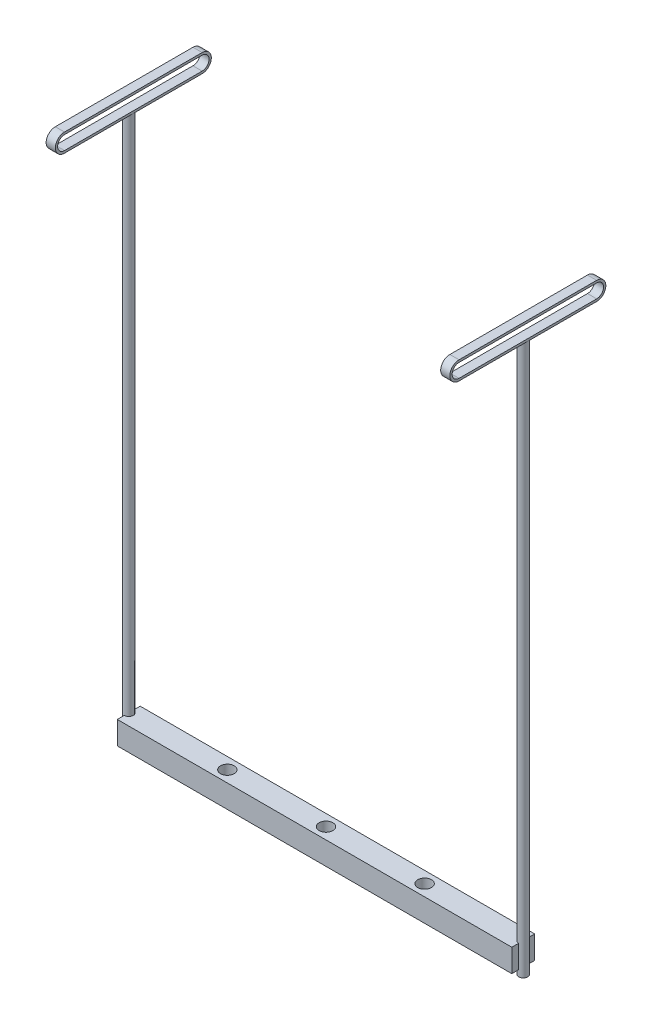
from build123d import *

# Parameters (mm, degrees)
BOSS_EXTRUDE1_DEPTH     = 10
SKETCH2_R               = 10
BOSS_EXTRUDE2_DEPTH     = 1200
SKETCH4_W               = 50
SKETCH4_H               = 50
BOSS_EXTRUDE3_DEPTH     = 860
CUT_EXTRUDE2_DEPTH      = 1468.122841414
CUT_EXTRUDE2_DEPTH_BACK = 1468.122841414
SKETCH6_R               = 15


with BuildPart() as part:
    # Sketch1 → Boss-Extrude1 (new, symmetric)
    with BuildSketch(Plane(origin=(0, 0, 0), x_dir=(0, 0, -1), z_dir=(1, 0, 0))):
        with BuildLine():
            Line((150, -20), (-150, -20))
            ThreePointArc((-150, -20), (-170, 0), (-150, 20))
            Line((-150, 20), (150, 20))
            ThreePointArc((150, 20), (170, 0), (150, -20))
        make_face()
        with BuildLine():
            Line((-150, 15), (150, 15))
            ThreePointArc((150, 15), (165, 0), (150, -15))
            Line((150, -15), (-150, -15))
            ThreePointArc((-150, -15), (-165, 0), (-150, 15))
        make_face(mode=Mode.SUBTRACT)
    boss_extrude1 = extrude(amount=BOSS_EXTRUDE1_DEPTH, both=True)

    # Sketch2 → Boss-Extrude2 (add)
    with BuildSketch(Plane.XZ.offset(20)):
        with Locations(Location((0, 0, 0), (0, 0, 180))):
            Circle(SKETCH2_R)
    boss_extrude2 = extrude(amount=BOSS_EXTRUDE2_DEPTH)

    # Sketch4 → Boss-Extrude3 (add)
    with BuildSketch(Plane(origin=(0, 0, 0), x_dir=(0, 0, -1), z_dir=(1, 0, 0))):
        with Locations((0, -1181.413801262)):
            Rectangle(SKETCH4_W, SKETCH4_H)
    extrude(amount=-BOSS_EXTRUDE3_DEPTH)

    # Sketch6 → Cut-Extrude2 (cut, two sides: drawn at the far end of the back side and taken through both)
    with BuildSketch(Plane(origin=(0, -1156.413801262, 0), x_dir=(1, 0, 0), z_dir=(0, 1, 0)).offset(-CUT_EXTRUDE2_DEPTH_BACK)):
        with Locations(Location((-645, 0, 0), (0, 0, 270))):
            Circle(SKETCH6_R)
        with Locations(Location((-430, 0, 0), (0, 0, 270))):
            Circle(SKETCH6_R)
        with Locations(Location((-215, 0, 0), (0, 0, 270))):
            Circle(SKETCH6_R)
    extrude(amount=CUT_EXTRUDE2_DEPTH + CUT_EXTRUDE2_DEPTH_BACK, mode=Mode.SUBTRACT)

    # Mirror1: Boss-Extrude2 across plane
    add(boss_extrude2.mirror(Plane(origin=(-430, 0, 0), x_dir=(0, 0, 1), z_dir=(1, 0, 0))))

    # Mirror2: Boss-Extrude1 across plane
    add(boss_extrude1.mirror(Plane(origin=(-430, 0, 0), x_dir=(0, 0, 1), z_dir=(1, 0, 0))))


solid = part.part
